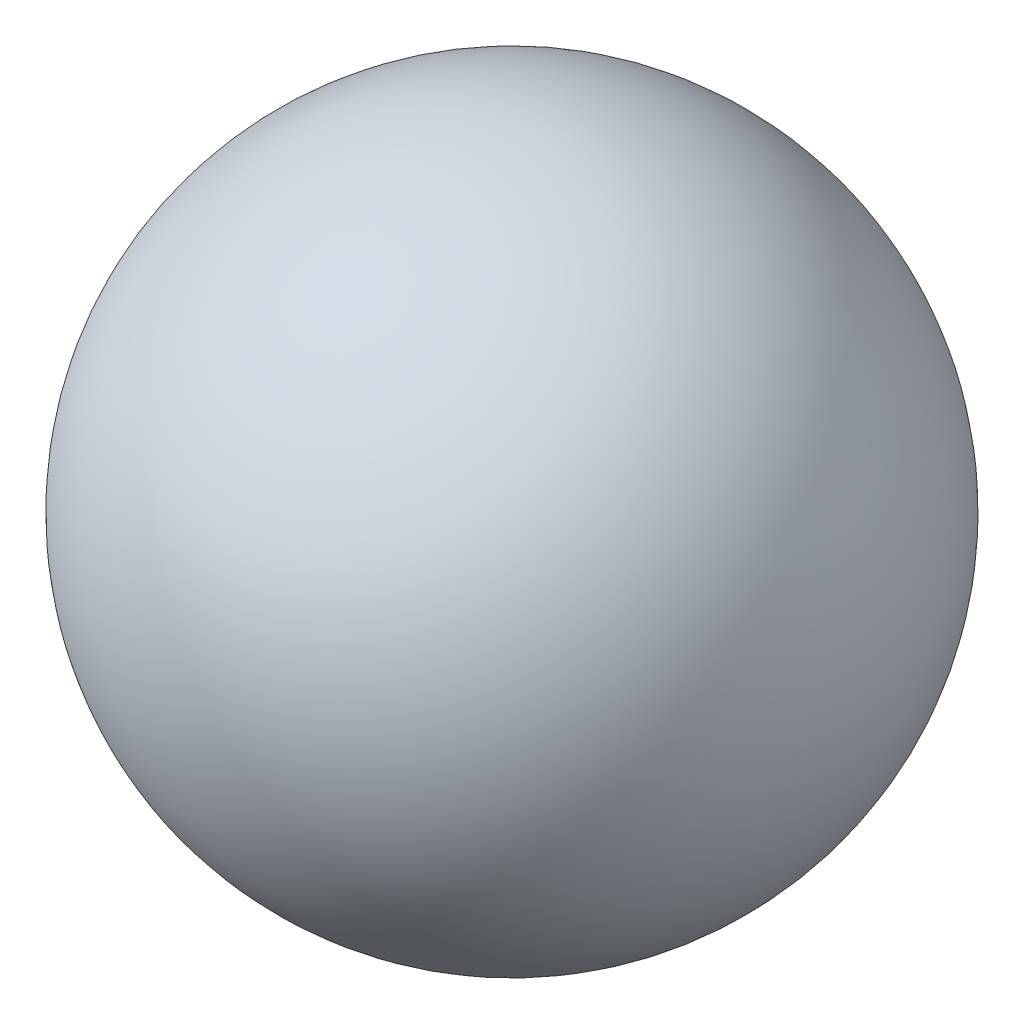
from build123d import *


with BuildPart() as part:
    # Sketch1 → Revolve1 (revolve)
    with BuildSketch(Plane(origin=(0, 0, 0), x_dir=(1, 0, 0), z_dir=(0, 1, 0))):
        with BuildLine():
            Line((0, 12.7), (0, -12.7))
            ThreePointArc((0, -12.7), (12.7, 0), (0, 12.7))
        make_face()
    revolve(axis=Axis((0, 0, -12.7), (0, 0, 1)))


solid = part.part
